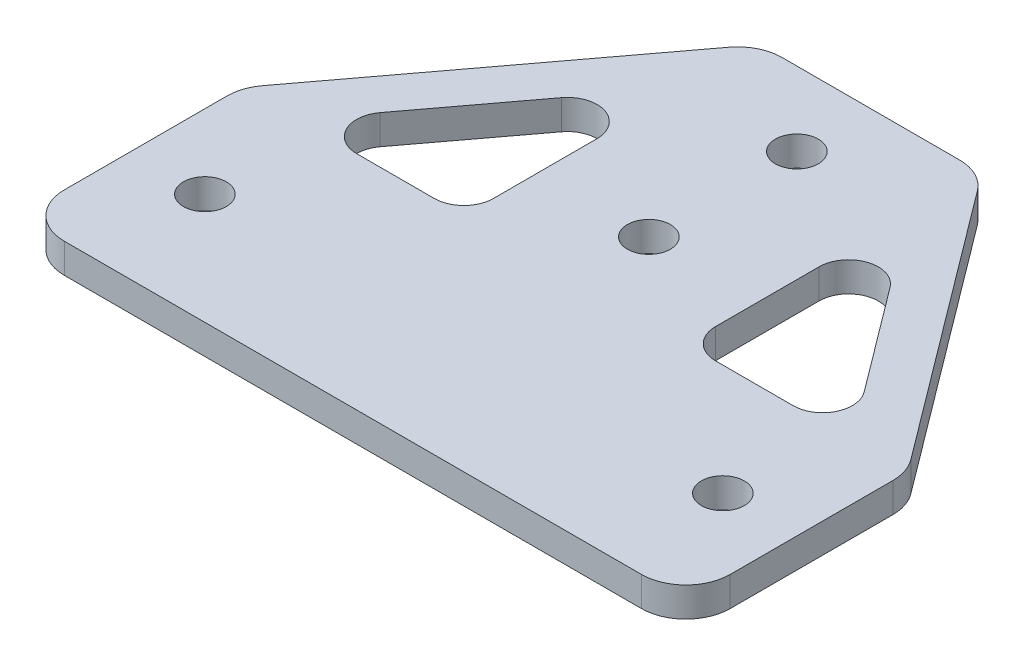
from build123d import *

# Parameters (mm, degrees)
SKETCH_1_R      = 1.45
EXTRUDE_1_DEPTH = 2
FILLET_2_R      = 3
FILLET_3_R      = 2


with BuildPart() as part:
    # 草图1 → 凸台-拉伸1 (new body)
    with BuildSketch(Plane(origin=(0, 0, 0), x_dir=(1, 0, 0), z_dir=(0, 1, 0))):
        Polygon((-7.5, 27.5), (-22.5, 7.5), (-22.5, -7.5), (22.5, -7.5), (22.5, 7.5), (7.5, 27.5), align=None)
        with Locations(Location((-17.5, 0, 0), (0, 0, 270))):
            Circle(SKETCH_1_R, mode=Mode.SUBTRACT)
        with Locations(Location((17.5, 0, 0), (0, 0, 270))):
            Circle(SKETCH_1_R, mode=Mode.SUBTRACT)
        with Locations(Location((0, 12.5, 0), (0, 0, 270))):
            Circle(SKETCH_1_R, mode=Mode.SUBTRACT)
        with Locations(Location((0, 22.5, 0), (0, 0, 270))):
            Circle(SKETCH_1_R, mode=Mode.SUBTRACT)
        Polygon((-7.5, 22.5), (-18.75, 7.5), (-7.5, 7.5), align=None, mode=Mode.SUBTRACT)
        Polygon((18.75, 7.5), (7.5, 7.5), (7.5, 22.5), align=None, mode=Mode.SUBTRACT)
    extrude(amount=EXTRUDE_1_DEPTH)

    # 圆角2
    fillet_2_edges = [part.edges().sort_by_distance(p)[0] for p in [
        (22.5, 1, -7.5),
        (22.5, 1, 7.5),
        (-22.5, 1, 7.5),
        (-22.5, 1, -7.5),
        (-7.5, 1, -27.5),
        (7.5, 1, -27.5),
    ]]
    fillet(fillet_2_edges, radius=FILLET_2_R)

    # 圆角3
    fillet_3_edges = [part.edges().sort_by_distance(p)[0] for p in [
        (-7.5, 1, -7.5),
        (-7.5, 1, -22.5),
        (-18.75, 1, -7.5),
        (18.75, 1, -7.5),
        (7.5, 1, -22.5),
        (7.5, 1, -7.5),
    ]]
    fillet(fillet_3_edges, radius=FILLET_3_R)


solid = part.part
